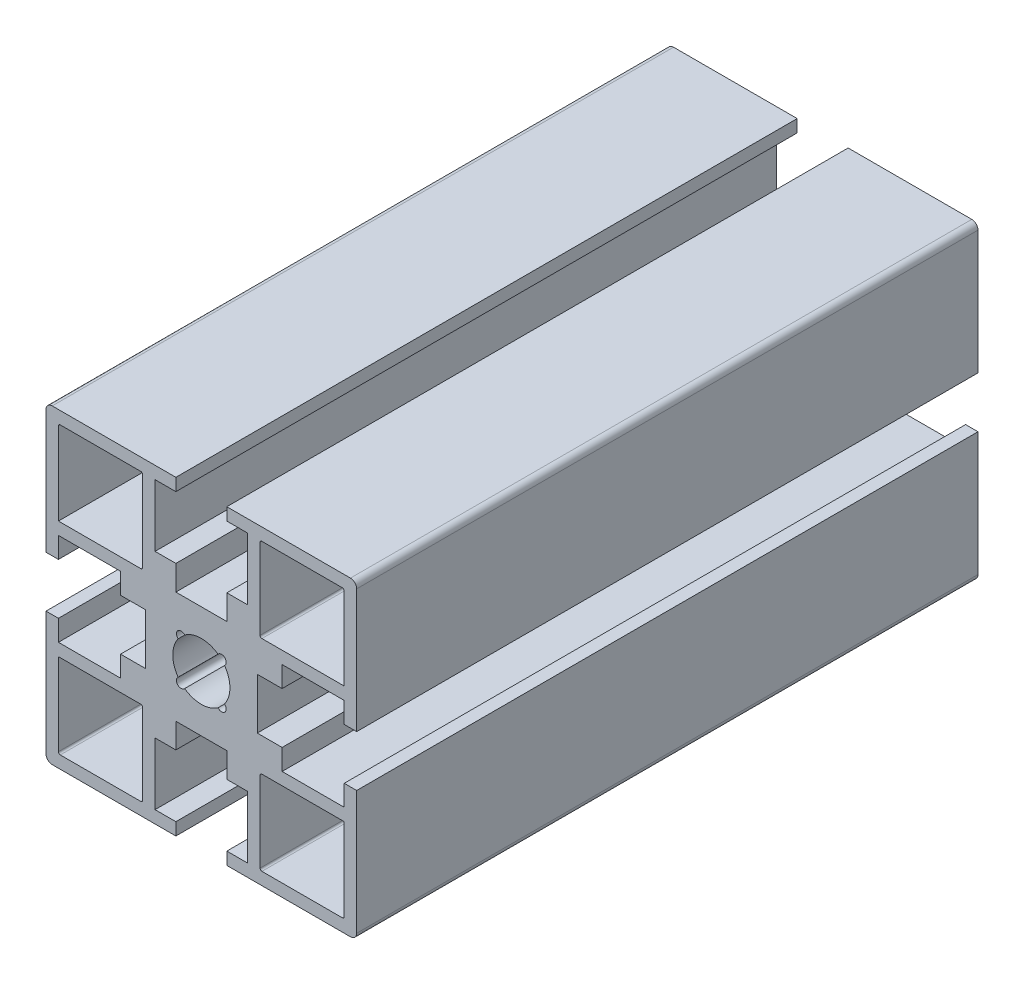
from build123d import *

# Parameters (mm, degrees)
EXTRUDE_1_DEPTH = 100


with BuildPart() as part:
    # 草图1 → 凸台-拉伸1 (new body)
    with BuildSketch(Plane.XY):
        with BuildLine():
            Line((-4.329808423, 24.195670518), (-24.229808423, 24.195670518))
            ThreePointArc((-24.229808423, 24.195670518), (-24.936915205, 23.902777299), (-25.229808423, 23.195670518))
            Line((-25.229808423, 23.195670518), (-25.229808423, 3.295670518))
            Line((-25.229808423, 3.295670518), (-23.229808423, 3.295670518))
            Line((-23.229808423, 3.295670518), (-23.229808423, 6.645670518))
            Line((-23.229808423, 6.645670518), (-13.229808423, 6.645670518))
            Line((-13.229808423, 6.645670518), (-13.229808423, 3.295670518))
            Line((-13.229808423, 3.295670518), (-9.229808423, 3.295670518))
            Line((-9.229808423, 3.295670518), (-9.229808423, -4.904329482))
            Line((-9.229808423, -4.904329482), (-13.229808423, -4.904329482))
            Line((-13.229808423, -4.904329482), (-13.229808423, -8.254329482))
            Line((-13.229808423, -8.254329482), (-23.229808423, -8.254329482))
            Line((-23.229808423, -8.254329482), (-23.229808423, -4.904329482))
            Line((-23.229808423, -4.904329482), (-25.229808423, -4.904329482))
            Line((-25.229808423, -4.904329482), (-25.229808423, -24.804329482))
            ThreePointArc((-25.229808423, -24.804329482), (-24.936915205, -25.511436263), (-24.229808423, -25.804329482))
            Line((-24.229808423, -25.804329482), (-4.329808423, -25.804329482))
            Line((-4.329808423, -25.804329482), (-4.329808423, -23.804329482))
            Line((-4.329808423, -23.804329482), (-7.679808423, -23.804329482))
            Line((-7.679808423, -23.804329482), (-7.679808423, -13.804329482))
            Line((-7.679808423, -13.804329482), (-4.329808423, -13.804329482))
            Line((-4.329808423, -13.804329482), (-4.329808423, -9.804329482))
            Line((-4.329808423, -9.804329482), (3.870191577, -9.804329482))
            Line((3.870191577, -9.804329482), (3.870191577, -13.804329482))
            Line((3.870191577, -13.804329482), (7.220191577, -13.804329482))
            Line((7.220191577, -13.804329482), (7.220191577, -23.804329482))
            Line((7.220191577, -23.804329482), (3.870191577, -23.804329482))
            Line((3.870191577, -23.804329482), (3.870191577, -25.804329482))
            Line((3.870191577, -25.804329482), (23.770191577, -25.804329482))
            ThreePointArc((23.770191577, -25.804329482), (24.477298358, -25.511436263), (24.770191577, -24.804329482))
            Line((24.770191577, -24.804329482), (24.770191577, -4.904329482))
            Line((24.770191577, -4.904329482), (22.770191577, -4.904329482))
            Line((22.770191577, -4.904329482), (22.770191577, -8.254329482))
            Line((22.770191577, -8.254329482), (12.770191577, -8.254329482))
            Line((12.770191577, -8.254329482), (12.770191577, -4.904329482))
            Line((12.770191577, -4.904329482), (8.770191577, -4.904329482))
            Line((8.770191577, -4.904329482), (8.770191577, 3.295670518))
            Line((8.770191577, 3.295670518), (12.770191577, 3.295670518))
            Line((12.770191577, 3.295670518), (12.770191577, 6.645670518))
            Line((12.770191577, 6.645670518), (22.770191577, 6.645670518))
            Line((22.770191577, 6.645670518), (22.770191577, 3.295670518))
            Line((22.770191577, 3.295670518), (24.770191577, 3.295670518))
            Line((24.770191577, 3.295670518), (24.770191577, 23.195670518))
            ThreePointArc((24.770191577, 23.195670518), (24.477298358, 23.902777299), (23.770191577, 24.195670518))
            Line((23.770191577, 24.195670518), (3.870191577, 24.195670518))
            Line((3.870191577, 24.195670518), (3.870191577, 22.195670518))
            Line((3.870191577, 22.195670518), (7.220191577, 22.195670518))
            Line((7.220191577, 22.195670518), (7.220191577, 12.195670518))
            Line((7.220191577, 12.195670518), (3.870191577, 12.195670518))
            Line((3.870191577, 12.195670518), (3.870191577, 8.195670518))
            Line((3.870191577, 8.195670518), (-4.329808423, 8.195670518))
            Line((-4.329808423, 8.195670518), (-4.329808423, 12.195670518))
            Line((-4.329808423, 12.195670518), (-7.679808423, 12.195670518))
            Line((-7.679808423, 12.195670518), (-7.679808423, 22.195670518))
            Line((-7.679808423, 22.195670518), (-4.329808423, 22.195670518))
            Line((-4.329808423, 22.195670518), (-4.329808423, 24.195670518))
        make_face()
        with BuildLine():
            Line((-23.229808423, 8.645670518), (-9.979808423, 8.645670518))
            ThreePointArc((-9.979808423, 8.645670518), (-9.767676389, 8.733538484), (-9.679808423, 8.945670518))
            Line((-9.679808423, 8.945670518), (-9.679808423, 21.895670518))
            ThreePointArc((-9.679808423, 21.895670518), (-9.767676389, 22.107802553), (-9.979808423, 22.195670518))
            Line((-9.979808423, 22.195670518), (-22.929808423, 22.195670518))
            ThreePointArc((-22.929808423, 22.195670518), (-23.141940458, 22.107802553), (-23.229808423, 21.895670518))
            Line((-23.229808423, 21.895670518), (-23.229808423, 8.645670518))
        make_face(mode=Mode.SUBTRACT)
        with BuildLine():
            Line((22.770191577, 8.645670518), (9.520191577, 8.645670518))
            ThreePointArc((9.520191577, 8.645670518), (9.308059542, 8.733538484), (9.220191577, 8.945670518))
            Line((9.220191577, 8.945670518), (9.220191577, 21.895670518))
            ThreePointArc((9.220191577, 21.895670518), (9.308059542, 22.107802553), (9.520191577, 22.195670518))
            Line((9.520191577, 22.195670518), (22.470191577, 22.195670518))
            ThreePointArc((22.470191577, 22.195670518), (22.682323611, 22.107802553), (22.770191577, 21.895670518))
            Line((22.770191577, 21.895670518), (22.770191577, 8.645670518))
        make_face(mode=Mode.SUBTRACT)
        with BuildLine():
            Line((-23.229808423, -10.254329482), (-9.979808423, -10.254329482))
            ThreePointArc((-9.979808423, -10.254329482), (-9.767676389, -10.342197447), (-9.679808423, -10.554329482))
            Line((-9.679808423, -10.554329482), (-9.679808423, -23.504329482))
            ThreePointArc((-9.679808423, -23.504329482), (-9.767676389, -23.716461516), (-9.979808423, -23.804329482))
            Line((-9.979808423, -23.804329482), (-22.929808423, -23.804329482))
            ThreePointArc((-22.929808423, -23.804329482), (-23.141940458, -23.716461516), (-23.229808423, -23.504329482))
            Line((-23.229808423, -23.504329482), (-23.229808423, -10.254329482))
        make_face(mode=Mode.SUBTRACT)
        with BuildLine():
            Line((22.770191577, -10.254329482), (9.520191577, -10.254329482))
            ThreePointArc((9.520191577, -10.254329482), (9.308059542, -10.342197447), (9.220191577, -10.554329482))
            Line((9.220191577, -10.554329482), (9.220191577, -23.504329482))
            ThreePointArc((9.220191577, -23.504329482), (9.308059542, -23.716461516), (9.520191577, -23.804329482))
            Line((9.520191577, -23.804329482), (22.470191577, -23.804329482))
            ThreePointArc((22.470191577, -23.804329482), (22.682323611, -23.716461516), (22.770191577, -23.504329482))
            Line((22.770191577, -23.504329482), (22.770191577, -10.254329482))
        make_face(mode=Mode.SUBTRACT)
        with BuildLine():
            ThreePointArc((2.451084423, 2.933693197), (-0.229808423, 3.795670518), (-2.91070127, 2.933693197))
            ThreePointArc((-2.91070127, 2.933693197), (-4.012829703, 2.978691798), (-3.967831102, 1.876563365))
            ThreePointArc((-3.967831102, 1.876563365), (-4.829808423, -0.804329482), (-3.967831102, -3.485222328))
            ThreePointArc((-3.967831102, -3.485222328), (-4.012829703, -4.587350761), (-2.91070127, -4.54235216))
            ThreePointArc((-2.91070127, -4.54235216), (-0.229808423, -5.404329482), (2.451084423, -4.54235216))
            ThreePointArc((2.451084423, -4.54235216), (3.553212856, -4.587350761), (3.508214255, -3.485222328))
            ThreePointArc((3.508214255, -3.485222328), (4.370191577, -0.804329482), (3.508214255, 1.876563365))
            ThreePointArc((3.508214255, 1.876563365), (3.553212856, 2.978691798), (2.451084423, 2.933693197))
        make_face(mode=Mode.SUBTRACT)
    extrude(amount=EXTRUDE_1_DEPTH)


solid = part.part
